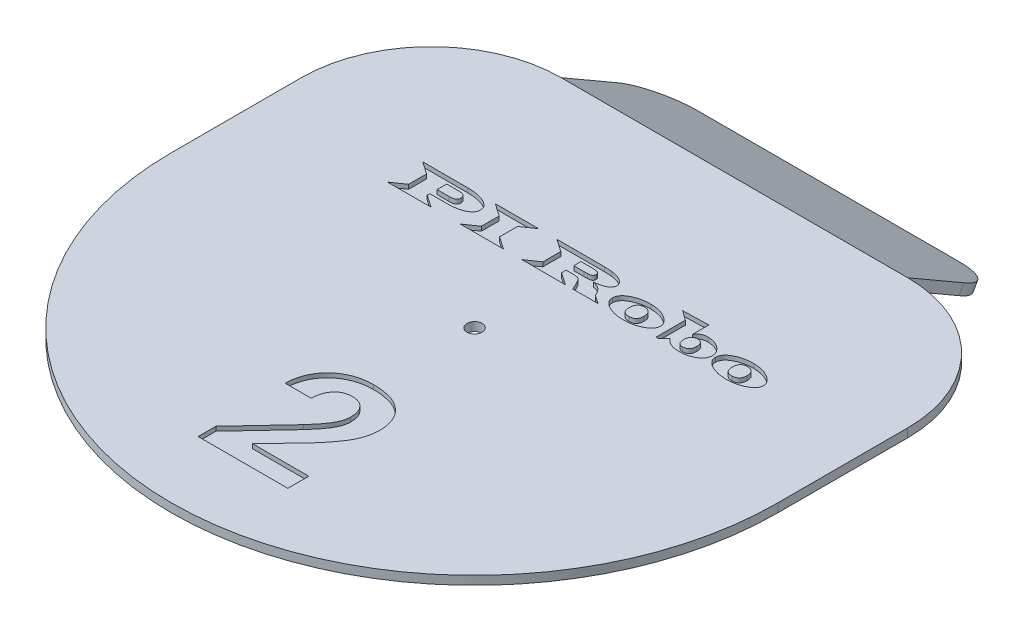
from build123d import *

# Parameters (mm, degrees)
BOSS_EXTRUDE1_DEPTH      = 2
CUT_EXTRUDE1_DEPTH       = 1
BOSS_EXTRUDE2_DEPTH      = 40
BOSS_EXTRUDE2_DEPTH_BACK = 40
FILLET1_R                = 10
SKETCH4_R                = 1.75
CUT_EXTRUDE2_DEPTH       = 10


with BuildPart() as part:
    # Sketch1 → Boss-Extrude1 (new body)
    with BuildSketch(Plane(origin=(0, 0, 0), x_dir=(1, 0, 0), z_dir=(0, 1, 0))):
        with BuildLine():
            Line((-70, 0), (-70, 30))
            ThreePointArc((-70, 30), (-61.213203436, 51.213203436), (-40, 60))
            Line((-40, 60), (40, 60))
            ThreePointArc((40, 60), (61.213203436, 51.213203436), (70, 30))
            Line((70, 30), (70, 0))
            ThreePointArc((70, 0), (0, -70), (-70, 0))
        make_face()
    extrude(amount=BOSS_EXTRUDE1_DEPTH)

    # Sketch2 → Cut-Extrude1 (cut)
    # profile 1 of 7: a face of its own
    with BuildSketch(Plane(origin=(0, 2, 0), x_dir=(1, 0, 0), z_dir=(0, 1, 0))):
        with BuildLine():
            Line((-39.182018294, 27.198253148), (-28.749726627, 27.198253148))
            add(Edge.make_bspline(
                [(-28.749726627, 27.198253148), (-28.540759959, 27.195390427), (-28.132309332, 27.189794894), (-27.533116335, 27.151819106), (-26.962310882, 27.086381694), (-26.418698697, 26.9942655), (-25.902645117, 26.877909568), (-25.415507649, 26.730919863), (-24.955205113, 26.561764658), (-24.593581705, 26.396517149), (-24.323397808, 26.250872451), (-24.132927126, 26.142968589), (-23.958369255, 26.027009202), (-23.793700105, 25.911944442), (-23.644545426, 25.789479814), (-23.50752858, 25.665135999), (-23.382824062, 25.537540619), (-23.271658186, 25.406045898), (-23.174286655, 25.269770395), (-23.088370956, 25.131127703), (-23.017400865, 24.987768113), (-22.957456562, 24.84191949), (-22.912798301, 24.691668437), (-22.879155703, 24.538606742), (-22.860046235, 24.38160638), (-22.857109273, 24.275847963), (-22.855629405, 24.222558703)],
                knots=[0, 0, 0, 0, 2.087090705, 4.079471203, 5.9937321, 7.822924926, 9.584003369, 11.273661289, 12.90132283, 14.478954604, 15.23919433, 15.966877183, 16.664247486, 17.331455289, 17.97238357, 18.590194536, 19.178789967, 19.753078417, 20.308078398, 20.850320854, 21.380223841, 21.90400754, 22.423307255, 22.943667391, 23.467738033, 24, 24, 24, 24], degree=3))
            add(Edge.make_bspline(
                [(-22.855629405, 24.222558703), (-22.860060003, 24.125569376), (-22.868814673, 23.933922676), (-22.935883952, 23.654189534), (-23.051721293, 23.392873945), (-23.208556639, 23.145487379), (-23.412378472, 22.91612731), (-23.661210728, 22.703416772), (-23.952635638, 22.505069889), (-24.288639882, 22.327061184), (-24.660432778, 22.164524204), (-25.066899353, 22.024072491), (-25.505283383, 21.907231711), (-25.975425694, 21.81037712), (-26.477808559, 21.73404163), (-27.013306908, 21.681871749), (-27.580879169, 21.647759699), (-27.970160464, 21.644413979), (-28.169865516, 21.642697592)],
                knots=[0, 0, 0, 0, 0.717437142, 1.41762465, 2.113884282, 2.824422768, 3.577074642, 4.375669699, 5.241708804, 6.180718279, 7.185744861, 8.242284492, 9.360224043, 10.541265472, 11.793337527, 13.119189121, 14.522116283, 16, 16, 16, 16], degree=3))
            Line((-28.169865516, 21.642697592), (-31.966740516, 21.642697592))
            Line((-31.966740516, 21.642697592), (-31.966740516, 21.042003148))
            Line((-31.966740516, 21.042003148), (-29.091740516, 19.087142037))
            Line((-29.091740516, 19.087142037), (-39.182018294, 19.087142037))
            Line((-39.182018294, 19.087142037), (-36.300073849, 21.07672537))
            Line((-36.300073849, 21.07672537), (-36.300073849, 25.226030925))
            Line((-36.300073849, 25.226030925), (-39.182018294, 27.198253148))
        make_face()
        with BuildLine():
            Line((-31.966740516, 23.309364259), (-29.197643294, 23.309364259))
            add(Edge.make_bspline(
                [(-29.197643294, 23.309364259), (-29.120089552, 23.310039255), (-28.970693699, 23.311339536), (-28.756291194, 23.320918206), (-28.561113752, 23.340260469), (-28.38594886, 23.365451864), (-28.229903407, 23.39847942), (-28.093156413, 23.437439826), (-27.97470326, 23.483565943), (-27.87537007, 23.540579242), (-27.789456128, 23.605437038), (-27.717687893, 23.683631865), (-27.656066808, 23.772670736), (-27.608204225, 23.87461018), (-27.569558544, 23.986920209), (-27.542484035, 24.110996586), (-27.524467019, 24.246916219), (-27.523038382, 24.341708201), (-27.522296071, 24.390961481)],
                knots=[0, 0, 0, 0, 1.607399621, 3.09641847, 4.446230494, 5.670930036, 6.762466651, 7.749348201, 8.615756757, 9.38935836, 10.116269223, 10.837617419, 11.579513673, 12.351998698, 13.163713441, 14.036656029, 14.979859599, 16, 16, 16, 16], degree=3))
            add(Edge.make_bspline(
                [(-27.522296071, 24.390961481), (-27.523639294, 24.437335118), (-27.526237082, 24.527021593), (-27.545951454, 24.656724995), (-27.576396819, 24.777798849), (-27.622333946, 24.889423949), (-27.679598175, 24.993357887), (-27.751691137, 25.087370188), (-27.835754701, 25.172873248), (-27.93174998, 25.250480778), (-28.043215945, 25.315811124), (-28.165403053, 25.374862169), (-28.301139771, 25.423456098), (-28.449232142, 25.463217042), (-28.610052989, 25.493614204), (-28.78327577, 25.516863908), (-28.969494751, 25.527828539), (-29.0980967, 25.530304829), (-29.164657183, 25.531586481)],
                knots=[0, 0, 0, 0, 0.979172184, 1.893716055, 2.765426739, 3.609882898, 4.436272778, 5.265100258, 6.10360728, 6.964623838, 7.864009384, 8.826325232, 9.82790424, 10.904344143, 12.06230992, 13.282913021, 14.593717879, 16, 16, 16, 16], degree=3))
            Line((-29.164657183, 25.531586481), (-31.966740516, 25.531586481))
            Line((-31.966740516, 25.531586481), (-31.966740516, 23.309364259))
        make_face(mode=Mode.SUBTRACT)
    # profile 2 of 7: a face of its own
    with BuildSketch(Plane(origin=(0, 2, 0), x_dir=(1, 0, 0), z_dir=(0, 1, 0))):
        Polygon((-22.404240516, 27.198253148), (-12.425073849, 27.198253148), (-15.300073849, 25.227767037), (-15.300073849, 21.069780925), (-12.425073849, 19.087142037), (-22.404240516, 19.087142037), (-19.522296071, 21.104503148), (-19.522296071, 25.191308703), align=None)
    # profile 3 of 7: a face of its own
    with BuildSketch(Plane(origin=(0, 2, 0), x_dir=(1, 0, 0), z_dir=(0, 1, 0))):
        with BuildLine():
            Line((-8.182018294, 27.198253148), (1.387426151, 27.198253148))
            Line((1.387426151, 27.198253148), (2.80756504, 27.198253148))
            Line((2.80756504, 27.198253148), (4.689509484, 27.083669814))
            add(Edge.make_bspline(
                [(4.689509484, 27.083669814), (4.810639646, 27.066865105), (5.04858905, 27.033853753), (5.395111728, 26.96604553), (5.724308705, 26.884595434), (6.035718856, 26.789361412), (6.329625963, 26.67981732), (6.606751409, 26.557746928), (6.863964998, 26.416914297), (7.104590193, 26.268580529), (7.320344193, 26.107299043), (7.511331198, 25.942165696), (7.670181748, 25.767836181), (7.805069797, 25.591607758), (7.90599309, 25.405243222), (7.980222888, 25.214839998), (8.025687829, 25.018093334), (8.030731786, 24.884828392), (8.033259484, 24.818044814)],
                knots=[0, 0, 0, 0, 1.344608738, 2.641363973, 3.880775494, 5.07247627, 6.220276055, 7.328437483, 8.399088701, 9.44265371, 10.43415842, 11.358504192, 12.214255043, 13.023748544, 13.792702854, 14.536082863, 15.266381527, 16, 16, 16, 16], degree=3))
            add(Edge.make_bspline(
                [(8.033259484, 24.818044814), (8.030613519, 24.752431957), (8.025434082, 24.623995789), (7.983672001, 24.436073568), (7.916255955, 24.258566088), (7.819814572, 24.090726935), (7.698250111, 23.932587561), (7.54770011, 23.785627793), (7.371636635, 23.648600443), (7.168021572, 23.521979386), (6.939070961, 23.403725427), (6.681180206, 23.299431776), (6.399218208, 23.199333289), (6.088001419, 23.114811052), (5.752200005, 23.033501891), (5.387831996, 22.967769569), (4.997793655, 22.907764913), (4.727840386, 22.87833833), (4.58881504, 22.863183703)],
                knots=[0, 0, 0, 0, 0.729034694, 1.427074301, 2.12984443, 2.83308586, 3.571939266, 4.341004906, 5.166209091, 6.048251972, 7.003835598, 8.028075508, 9.139355141, 10.329214249, 11.612323367, 12.980565391, 14.444997747, 16, 16, 16, 16], degree=3))
            add(Edge.make_bspline(
                [(4.58881504, 22.863183703), (4.67645449, 22.848814621), (4.84820599, 22.820654797), (5.096783198, 22.757880939), (5.333582892, 22.688307299), (5.556642997, 22.603247738), (5.765057873, 22.503112033), (5.962891339, 22.394324108), (6.146759384, 22.270864057), (6.319180477, 22.133802766), (6.482650613, 21.979789521), (6.642120379, 21.808550349), (6.796249065, 21.615757686), (6.949806926, 21.405668918), (7.098299037, 21.174366609), (7.244004989, 20.924011481), (7.386680298, 20.65476938), (7.475563229, 20.466564196), (7.521106706, 20.370128148)],
                knots=[0, 0, 0, 0, 1.051953778, 2.061567464, 3.035690898, 3.975611771, 4.886669183, 5.773901752, 6.648830882, 7.507784047, 8.381126039, 9.307946329, 10.278296702, 11.304336587, 12.390493941, 13.533755484, 14.736300084, 16, 16, 16, 16], degree=3))
            Line((7.521106706, 20.370128148), (9.442981706, 19.087142037))
            Line((9.442981706, 19.087142037), (3.576662262, 19.087142037))
            add(Edge.make_bspline(
                [(3.576662262, 19.087142037), (3.516208289, 19.228478863), (3.399209783, 19.50201254), (3.224630698, 19.896200522), (3.054143034, 20.25955204), (2.890058057, 20.592843467), (2.7300627, 20.895514862), (2.576384541, 21.16816438), (2.427379528, 21.410188059), (2.326036568, 21.5585568), (2.278051151, 21.628808703)],
                knots=[0, 0, 0, 0, 1.29035272, 2.497260861, 3.618578266, 4.659170008, 5.615275662, 6.491943265, 7.285942206, 8, 8, 8, 8], degree=3))
            add(Edge.make_bspline(
                [(2.278051151, 21.628808703), (2.247605457, 21.666074404), (2.184391473, 21.743448677), (2.057128762, 21.836735117), (1.903256483, 21.914920314), (1.720843924, 21.978301712), (1.510682302, 22.027214836), (1.272774236, 22.063661889), (1.006400903, 22.08350847), (0.819171208, 22.085890168), (0.720759484, 22.087142037)],
                knots=[0, 0, 0, 0, 0.686392361, 1.42514724, 2.236342754, 3.150536929, 4.181016092, 5.320691751, 6.591701259, 8, 8, 8, 8], degree=3))
            Line((0.720759484, 22.087142037), (-0.966740516, 22.087142037))
            Line((-0.966740516, 22.087142037), (-0.966740516, 21.040267037))
            Line((-0.966740516, 21.040267037), (1.915203929, 19.087142037))
            Line((1.915203929, 19.087142037), (-8.182018294, 19.087142037))
            Line((-8.182018294, 19.087142037), (-5.300073849, 21.074989259))
            Line((-5.300073849, 21.074989259), (-5.300073849, 25.20172537))
            Line((-5.300073849, 25.20172537), (-8.182018294, 27.198253148))
        make_face()
        with BuildLine():
            Line((-0.966740516, 23.864919814), (1.380481706, 23.863183703))
            Line((1.380481706, 23.863183703), (2.179092817, 23.875336481))
            add(Edge.make_bspline(
                [(2.179092817, 23.875336481), (2.271873322, 23.877079382), (2.446182228, 23.880353812), (2.688991367, 23.919404192), (2.897564284, 23.976737321), (3.067910404, 24.064801422), (3.204769874, 24.175308224), (3.298633933, 24.31607493), (3.357084197, 24.480325053), (3.363319809, 24.598191708), (3.366592817, 24.660058703)],
                knots=[0, 0, 0, 0, 1.381391365, 2.595252319, 3.656883097, 4.590505361, 5.435358798, 6.248761601, 7.080792983, 8, 8, 8, 8], degree=3))
            add(Edge.make_bspline(
                [(3.366592817, 24.660058703), (3.366068257, 24.701253112), (3.365064348, 24.780091402), (3.344284504, 24.892824901), (3.315878735, 24.995925087), (3.274439993, 25.088961364), (3.218979385, 25.170402077), (3.152730169, 25.242407343), (3.073348449, 25.303603086), (2.980408655, 25.355287231), (2.867741646, 25.396859261), (2.733422325, 25.435295284), (2.571904355, 25.4622639), (2.386329595, 25.489637857), (2.174025173, 25.506396313), (1.936880827, 25.523853685), (1.673315305, 25.528579785), (1.489272886, 25.530551276), (1.392634484, 25.531586481)],
                knots=[0, 0, 0, 0, 0.806113006, 1.54274748, 2.239247148, 2.899225326, 3.528461942, 4.162587489, 4.809271197, 5.484667002, 6.23882332, 7.158143537, 8.219420418, 9.445052395, 10.834583391, 12.392003997, 14.105485854, 16, 16, 16, 16], degree=3))
            Line((1.392634484, 25.531586481), (-0.966740516, 25.531586481))
            Line((-0.966740516, 25.531586481), (-0.966740516, 23.864919814))
        make_face(mode=Mode.SUBTRACT)
    # profile 4 of 7: a face of its own
    with BuildSketch(Plane(origin=(0, 2, 0), x_dir=(1, 0, 0), z_dir=(0, 1, 0))):
        with BuildLine():
            add(Edge.make_bspline(
                [(15.614856706, 25.087142037), (15.793769589, 25.084153637), (16.147012444, 25.078253387), (16.668575836, 25.031063944), (17.173832419, 24.950012283), (17.66466613, 24.842286109), (18.139069404, 24.698373913), (18.59944618, 24.527349048), (19.042857226, 24.321364848), (19.397663775, 24.125202169), (19.668197063, 23.956614074), (19.858576045, 23.828004037), (20.035159336, 23.695687023), (20.200529784, 23.563519087), (20.349911546, 23.425955108), (20.490197739, 23.290868067), (20.612633965, 23.148073178), (20.726583736, 23.007536077), (20.824222944, 22.861699931), (20.909208156, 22.714238698), (20.982744627, 22.564997064), (21.042144529, 22.413457276), (21.087293466, 22.259375459), (21.120653108, 22.103364244), (21.139909658, 21.944683177), (21.142881328, 21.838348745), (21.144370595, 21.785058703)],
                knots=[0, 0, 0, 0, 1.837849433, 3.628621764, 5.374288145, 7.092166258, 8.786843572, 10.463108596, 12.133586095, 13.804729968, 14.624608915, 15.407866565, 16.164101214, 16.891120617, 17.581379905, 18.249813131, 18.890187209, 19.512279102, 20.107542945, 20.690840616, 21.259844263, 21.815172851, 22.360708781, 22.907571302, 23.452523806, 24, 24, 24, 24], degree=3))
            add(Edge.make_bspline(
                [(21.144370595, 21.785058703), (21.142867231, 21.734084775), (21.139867299, 21.632367348), (21.120884582, 21.481108264), (21.08690869, 21.332767348), (21.042606214, 21.186444722), (20.982139537, 21.043744338), (20.911723392, 20.902430449), (20.825148577, 20.76540908), (20.728550725, 20.629174113), (20.61606308, 20.497749608), (20.493203684, 20.366737635), (20.355503578, 20.240654429), (20.205374045, 20.116701402), (20.041950161, 19.995917548), (19.866670988, 19.875388287), (19.677295259, 19.759783216), (19.407048417, 19.608529495), (19.050957458, 19.43394488), (18.603183439, 19.249953123), (18.133399201, 19.099200051), (17.644691325, 18.970761108), (17.134438937, 18.875330629), (16.604967331, 18.803528854), (16.054196864, 18.761554013), (15.680321193, 18.756422741), (15.489856706, 18.753808703)],
                knots=[0, 0, 0, 0, 0.525963223, 1.049548814, 1.569581853, 2.094595316, 2.624609663, 3.166661502, 3.721710915, 4.295021523, 4.888256967, 5.504887899, 6.147118798, 6.81297789, 7.512746824, 8.243077163, 9.006998881, 9.80092105, 11.437772379, 13.095367525, 14.790917316, 16.524372204, 18.305450123, 20.142890536, 22.035062367, 24, 24, 24, 24], degree=3))
            add(Edge.make_bspline(
                [(15.489856706, 18.753808703), (15.302844342, 18.756224201), (14.934665028, 18.760979695), (14.392792135, 18.805999567), (13.870291891, 18.876051863), (13.367952377, 18.976453151), (12.886109815, 19.106826858), (12.42447096, 19.265244293), (11.982316562, 19.450520329), (11.631796861, 19.630044603), (11.366480107, 19.785729293), (11.180387478, 19.905416359), (11.007353128, 20.028432672), (10.845807909, 20.153523213), (10.699353715, 20.284232318), (10.562078752, 20.41538977), (10.441633959, 20.553418628), (10.330925601, 20.691847252), (10.235264987, 20.835126712), (10.152231473, 20.980952273), (10.079292646, 21.129206736), (10.023298251, 21.282123344), (9.976513221, 21.437731169), (9.946527888, 21.597245526), (9.926363296, 21.759663117), (9.923560455, 21.868909049), (9.922148373, 21.923947592)],
                knots=[0, 0, 0, 0, 1.921282108, 3.782511005, 5.583019273, 7.33580106, 9.042267682, 10.708389971, 12.347326821, 13.96427154, 14.750571526, 15.507660561, 16.236939724, 16.931627978, 17.605701104, 18.253287615, 18.880937619, 19.486451197, 20.073582837, 20.648881512, 21.210054547, 21.76892296, 22.320274907, 22.877717916, 23.434589742, 24, 24, 24, 24], degree=3))
            add(Edge.make_bspline(
                [(9.922148373, 21.923947592), (9.923597535, 21.978975667), (9.926458841, 22.087626141), (9.945874297, 22.24918101), (9.979190149, 22.406944536), (10.024482019, 22.56268214), (10.082921798, 22.715271479), (10.157630103, 22.863381088), (10.241433926, 23.00973635), (10.342397832, 23.150313297), (10.452942868, 23.289991181), (10.578579496, 23.42488254), (10.716648001, 23.557441123), (10.866832477, 23.687334271), (11.031725127, 23.812483753), (11.20849422, 23.936015502), (11.3995843, 24.05513842), (11.67182125, 24.21095495), (12.03109389, 24.390462124), (12.483622441, 24.575722001), (12.955660056, 24.734120687), (13.447898593, 24.864466079), (13.961179235, 24.965065702), (14.494695173, 25.03479231), (15.048101033, 25.080037723), (15.423793512, 25.084747049), (15.614856706, 25.087142037)],
                knots=[0, 0, 0, 0, 0.557156565, 1.100080723, 1.644804269, 2.188107741, 2.740902632, 3.296454622, 3.866285149, 4.446653232, 5.046970628, 5.668973566, 6.311316644, 6.98438203, 7.678195975, 8.406416597, 9.167286984, 9.957314225, 11.582023668, 13.229492501, 14.904583907, 16.620100403, 18.381779528, 20.196652527, 22.065759217, 24, 24, 24, 24], degree=3))
        make_face()
        with BuildLine():
            add(Edge.make_bspline(
                [(15.460342817, 23.753808703), (15.393716389, 23.752724139), (15.264105477, 23.750614294), (15.076579073, 23.72719872), (14.901267938, 23.691656451), (14.739599384, 23.63937161), (14.590066856, 23.573321859), (14.454243935, 23.491534374), (14.331559958, 23.394937575), (14.220996808, 23.284569665), (14.123072604, 23.158911749), (14.040206847, 23.016964346), (13.968963774, 22.861624272), (13.909479389, 22.692124611), (13.864694989, 22.507156371), (13.834559147, 22.307271434), (13.815059429, 22.093311556), (13.812404305, 21.945983093), (13.811037262, 21.870128148)],
                knots=[0, 0, 0, 0, 1.114286815, 2.167664299, 3.157145725, 4.103416758, 5.005031699, 5.886877054, 6.748934553, 7.611698813, 8.494978539, 9.406728952, 10.355622403, 11.350962156, 12.407850093, 13.535022166, 14.730857883, 16, 16, 16, 16], degree=3))
            add(Edge.make_bspline(
                [(13.811037262, 21.870128148), (13.812468457, 21.798328986), (13.815255304, 21.658520466), (13.833920725, 21.455909765), (13.86640928, 21.267008986), (13.914018465, 21.092478171), (13.971692454, 20.930583493), (14.045250901, 20.783169939), (14.132611656, 20.650737603), (14.231985991, 20.530995875), (14.346496341, 20.426324571), (14.472892206, 20.333872821), (14.613801664, 20.257017952), (14.767143132, 20.194848344), (14.933476598, 20.146034494), (15.113125664, 20.111888791), (15.3059061, 20.090849699), (15.43887499, 20.088400742), (15.507217817, 20.087142037)],
                knots=[0, 0, 0, 0, 1.220666772, 2.376902632, 3.455829822, 4.474958959, 5.449215644, 6.373240998, 7.268316841, 8.141327852, 9.011673513, 9.899255415, 10.797569994, 11.733048495, 12.707503886, 13.73984573, 14.838334792, 16, 16, 16, 16], degree=3))
            add(Edge.make_bspline(
                [(15.507217817, 20.087142037), (15.577872495, 20.088392032), (15.714877867, 20.090815878), (15.913453885, 20.111829646), (16.098719254, 20.146428241), (16.270615814, 20.194100127), (16.428645416, 20.257531418), (16.573342733, 20.332996583), (16.703254743, 20.424967049), (16.820392792, 20.529242638), (16.923668866, 20.64830019), (17.012170826, 20.781875735), (17.089679396, 20.927785646), (17.149117825, 21.089471011), (17.198966881, 21.263246153), (17.230021803, 21.452022179), (17.252014747, 21.653752201), (17.254302463, 21.793093782), (17.255481706, 21.864919814)],
                knots=[0, 0, 0, 0, 1.185313575, 2.298422863, 3.345893796, 4.344939956, 5.286204345, 6.198419916, 7.076667119, 7.950015545, 8.824227283, 9.712987041, 10.633793322, 11.589620999, 12.598014559, 13.662850415, 14.795275753, 16, 16, 16, 16], degree=3))
            add(Edge.make_bspline(
                [(17.255481706, 21.864919814), (17.254269325, 21.941365679), (17.251922382, 22.089350554), (17.230451254, 22.303971681), (17.197298642, 22.504185868), (17.145753699, 22.688973793), (17.08432752, 22.859956157), (17.007554865, 23.016494332), (16.915208917, 23.156937717), (16.81005856, 23.284215867), (16.68978285, 23.395690296), (16.554482804, 23.491513963), (16.406321446, 23.573877181), (16.243268274, 23.639239116), (16.067325896, 23.691898403), (15.876970047, 23.727083815), (15.673321237, 23.750673282), (15.532752974, 23.752742697), (15.460342817, 23.753808703)],
                knots=[0, 0, 0, 0, 1.227077254, 2.375391733, 3.459985042, 4.481108371, 5.451198118, 6.373708035, 7.273140296, 8.143993249, 9.018457355, 9.897696895, 10.800195628, 11.733683763, 12.712677056, 13.744105889, 14.837933656, 16, 16, 16, 16], degree=3))
        make_face(mode=Mode.SUBTRACT)
    # profile 5 of 7: a face of its own
    with BuildSketch(Plane(origin=(0, 2, 0), x_dir=(1, 0, 0), z_dir=(0, 1, 0))):
        with BuildLine():
            Line((26.477703929, 27.594086481), (26.477703929, 23.859711481))
            add(Edge.make_bspline(
                [(26.477703929, 23.859711481), (26.539368291, 23.957632587), (26.659682943, 24.148688543), (26.881000339, 24.399828747), (27.126381252, 24.614160829), (27.40132679, 24.786946349), (27.700329312, 24.924242809), (28.026850413, 25.018520444), (28.378366297, 25.077119972), (28.621559561, 25.083735249), (28.746801151, 25.087142037)],
                knots=[0, 0, 0, 0, 1.022279641, 1.99459159, 2.949099627, 3.894947189, 4.857112196, 5.850053645, 6.892803625, 8, 8, 8, 8], degree=3))
            add(Edge.make_bspline(
                [(28.746801151, 25.087142037), (28.891011843, 25.084070687), (29.174942826, 25.078023622), (29.593023976, 25.032313796), (29.995193639, 24.955765351), (30.382304175, 24.850200075), (30.753674445, 24.712739629), (31.109025931, 24.542882124), (31.450049396, 24.345403019), (31.770348393, 24.118817431), (32.064638525, 23.874276528), (32.323476714, 23.615023356), (32.542675718, 23.345007022), (32.721208857, 23.063438457), (32.862126382, 22.771966422), (32.961399811, 22.469050409), (33.02293828, 22.155614063), (33.029799628, 21.942745546), (33.033259484, 21.835405925)],
                knots=[0, 0, 0, 0, 1.165419286, 2.294549992, 3.394442227, 4.47129857, 5.53388993, 6.590441884, 7.650992988, 8.715096554, 9.757735274, 10.740033284, 11.671400499, 12.562861118, 13.428978512, 14.280948806, 15.133163014, 16, 16, 16, 16], degree=3))
            add(Edge.make_bspline(
                [(33.033259484, 21.835405925), (33.029524581, 21.733770367), (33.022126843, 21.532460441), (32.954569436, 21.237772757), (32.847968302, 20.954568823), (32.696537165, 20.68397598), (32.502782959, 20.425484099), (32.268280079, 20.177724818), (31.989816931, 19.943122135), (31.672376858, 19.724520391), (31.326152786, 19.521855565), (30.954818195, 19.347272817), (30.565196121, 19.197077583), (30.155592794, 19.076325642), (29.727674867, 18.980373), (29.279796395, 18.913275597), (28.812360006, 18.873009524), (28.493988536, 18.867649296), (28.331870595, 18.864919814)],
                knots=[0, 0, 0, 0, 0.796237427, 1.577110405, 2.358629598, 3.163259, 4.000308037, 4.886570474, 5.833375326, 6.850819788, 7.906529186, 8.976584172, 10.065743852, 11.178790693, 12.323019612, 13.502967579, 14.72848608, 16, 16, 16, 16], degree=3))
            add(Edge.make_bspline(
                [(28.331870595, 18.864919814), (28.228820001, 18.86552244), (28.026580835, 18.866705108), (27.729029558, 18.887764057), (27.442494979, 18.915150502), (27.167138569, 18.960322924), (26.902457711, 19.012387484), (26.648808073, 19.079392795), (26.406245404, 19.156754678), (26.17471802, 19.246921367), (25.954841187, 19.35048571), (25.745034466, 19.463551686), (25.54763092, 19.592182377), (25.360585981, 19.730300322), (25.183507874, 19.88039824), (25.019601656, 20.043675689), (24.864616926, 20.217902014), (24.772457975, 20.343319067), (24.725967817, 20.406586481)],
                knots=[0, 0, 0, 0, 1.211015256, 2.376645362, 3.504997887, 4.593162494, 5.655092037, 6.674762434, 7.675098661, 8.646521921, 9.592948578, 10.530533145, 11.445664068, 12.359934977, 13.262310394, 14.171429582, 15.077566246, 16, 16, 16, 16], degree=3))
            Line((24.725967817, 20.406586481), (23.304092817, 19.087142037))
            Line((23.304092817, 19.087142037), (22.811037262, 19.087142037))
            Line((22.811037262, 19.087142037), (22.811037262, 25.851030925))
            Line((22.811037262, 25.851030925), (20.585342817, 27.45172537))
            Line((20.585342817, 27.45172537), (26.477703929, 27.594086481))
        make_face()
        with BuildLine():
            add(Edge.make_bspline(
                [(27.965551151, 23.531586481), (27.915688711, 23.530446919), (27.817169124, 23.528195341), (27.672381036, 23.504392201), (27.532792562, 23.468025228), (27.397905473, 23.417724139), (27.269208441, 23.350899722), (27.145399312, 23.270620194), (27.026539517, 23.176163691), (26.914485792, 23.067755388), (26.812892133, 22.94626), (26.721470244, 22.816556323), (26.646990688, 22.67536831), (26.583579516, 22.526584765), (26.537823941, 22.367076858), (26.502447647, 22.199535788), (26.481547889, 22.022275083), (26.479002926, 21.900853837), (26.477703929, 21.838878148)],
                knots=[0, 0, 0, 0, 0.950082381, 1.877199043, 2.789952221, 3.697956497, 4.615964793, 5.549560977, 6.507811868, 7.506756779, 8.517036136, 9.524176473, 10.52646835, 11.555321562, 12.6028262, 13.684984479, 14.818372503, 16, 16, 16, 16], degree=3))
            add(Edge.make_bspline(
                [(26.477703929, 21.838878148), (26.478679159, 21.772877035), (26.48057265, 21.644730273), (26.495872945, 21.458447874), (26.523283141, 21.284897687), (26.562267951, 21.124539655), (26.607400474, 20.9750897), (26.66905829, 20.840427658), (26.73863514, 20.717317408), (26.818301681, 20.606558135), (26.911629541, 20.510715883), (27.014722922, 20.42678006), (27.128034477, 20.354892835), (27.253211203, 20.297511743), (27.388227772, 20.252465557), (27.534445661, 20.221607076), (27.690730599, 20.202321746), (27.798825745, 20.199635305), (27.85444004, 20.198253148)],
                knots=[0, 0, 0, 0, 1.292162163, 2.508842517, 3.656337638, 4.728164974, 5.738707595, 6.707410992, 7.620931959, 8.50480957, 9.370265691, 10.232079648, 11.102859884, 11.989999715, 12.921611963, 13.883932619, 14.911296198, 16, 16, 16, 16], degree=3))
            add(Edge.make_bspline(
                [(27.85444004, 20.198253148), (27.9152742, 20.199472428), (28.033844229, 20.201848889), (28.205633749, 20.223527833), (28.366343109, 20.255529457), (28.514971944, 20.302361443), (28.651684089, 20.363827207), (28.777345983, 20.437754511), (28.889656297, 20.528180024), (28.990648752, 20.630613502), (29.079759579, 20.746956304), (29.158906922, 20.875398233), (29.22159792, 21.019359389), (29.277278311, 21.174780179), (29.315135645, 21.345321074), (29.344639868, 21.528473663), (29.364800679, 21.725010571), (29.365982834, 21.860816904), (29.366592817, 21.930892037)],
                knots=[0, 0, 0, 0, 1.107758089, 2.159097921, 3.149469302, 4.089698034, 4.990998729, 5.87511836, 6.737860228, 7.610083061, 8.48941273, 9.402474813, 10.350883438, 11.344448038, 12.405678595, 13.527048282, 14.723973959, 16, 16, 16, 16], degree=3))
            add(Edge.make_bspline(
                [(29.366592817, 21.930892037), (29.365898879, 21.995762186), (29.364557831, 22.121125025), (29.345639302, 22.302416441), (29.321114077, 22.471608069), (29.283196117, 22.628736874), (29.23195664, 22.772705852), (29.174348916, 22.90607446), (29.101671502, 23.025671983), (29.018778581, 23.132598462), (28.926267105, 23.228719917), (28.820015839, 23.307943852), (28.705492568, 23.379204934), (28.577097001, 23.43322929), (28.439981181, 23.479463189), (28.291373981, 23.510239499), (28.132029628, 23.527018763), (28.022304196, 23.530029331), (27.965551151, 23.531586481)],
                knots=[0, 0, 0, 0, 1.276677762, 2.467204882, 3.585640142, 4.641368977, 5.64320646, 6.59192373, 7.496718486, 8.390177138, 9.252351838, 10.11384858, 10.993245366, 11.901477695, 12.849167955, 13.839206816, 14.882377683, 16, 16, 16, 16], degree=3))
        make_face(mode=Mode.SUBTRACT)
    # profile 6 of 7: a face of its own
    with BuildSketch(Plane(origin=(0, 2, 0), x_dir=(1, 0, 0), z_dir=(0, 1, 0))):
        with BuildLine():
            add(Edge.make_bspline(
                [(39.392634484, 25.087142037), (39.571547367, 25.084153637), (39.924790222, 25.078253387), (40.446353614, 25.031063944), (40.951610196, 24.950012283), (41.442443907, 24.842286109), (41.916847182, 24.698373913), (42.377223958, 24.527349048), (42.820635004, 24.321364848), (43.175441552, 24.125202169), (43.445974841, 23.956614074), (43.636353823, 23.828004037), (43.812937114, 23.695687023), (43.978307562, 23.563519087), (44.127689324, 23.425955108), (44.267975517, 23.290868067), (44.390411743, 23.148073178), (44.504361514, 23.007536077), (44.602000721, 22.861699931), (44.686985934, 22.714238698), (44.760522405, 22.564997064), (44.819922307, 22.413457276), (44.865071244, 22.259375459), (44.898430886, 22.103364244), (44.917687435, 21.944683177), (44.920659105, 21.838348745), (44.922148373, 21.785058703)],
                knots=[0, 0, 0, 0, 1.837849433, 3.628621764, 5.374288145, 7.092166258, 8.786843572, 10.463108596, 12.133586095, 13.804729968, 14.624608915, 15.407866565, 16.164101214, 16.891120617, 17.581379905, 18.249813131, 18.890187209, 19.512279102, 20.107542945, 20.690840616, 21.259844263, 21.815172851, 22.360708781, 22.907571302, 23.452523806, 24, 24, 24, 24], degree=3))
            add(Edge.make_bspline(
                [(44.922148373, 21.785058703), (44.920645009, 21.734084775), (44.917645077, 21.632367348), (44.89866236, 21.481108264), (44.864686468, 21.332767348), (44.820383992, 21.186444722), (44.759917315, 21.043744338), (44.68950117, 20.902430449), (44.602926354, 20.76540908), (44.506328503, 20.629174113), (44.393840857, 20.497749608), (44.270981462, 20.366737635), (44.133281356, 20.240654429), (43.983151823, 20.116701402), (43.819727939, 19.995917548), (43.644448765, 19.875388287), (43.455073036, 19.759783216), (43.184826195, 19.608529495), (42.828735236, 19.43394488), (42.380961217, 19.249953123), (41.911176979, 19.099200051), (41.422469103, 18.970761108), (40.912216715, 18.875330629), (40.382745109, 18.803528854), (39.831974642, 18.761554013), (39.458098971, 18.756422741), (39.267634484, 18.753808703)],
                knots=[0, 0, 0, 0, 0.525963223, 1.049548814, 1.569581853, 2.094595316, 2.624609663, 3.166661502, 3.721710915, 4.295021523, 4.888256967, 5.504887899, 6.147118798, 6.81297789, 7.512746824, 8.243077163, 9.006998881, 9.80092105, 11.437772379, 13.095367525, 14.790917316, 16.524372204, 18.305450123, 20.142890536, 22.035062367, 24, 24, 24, 24], degree=3))
            add(Edge.make_bspline(
                [(39.267634484, 18.753808703), (39.08062212, 18.756224201), (38.712442806, 18.760979695), (38.170569913, 18.805999567), (37.648069669, 18.876051863), (37.145730155, 18.976453151), (36.663887592, 19.106826858), (36.202248738, 19.265244293), (35.760094339, 19.450520329), (35.409574638, 19.630044603), (35.144257884, 19.785729293), (34.958165256, 19.905416359), (34.785130906, 20.028432672), (34.623585686, 20.153523213), (34.477131492, 20.284232318), (34.339856529, 20.41538977), (34.219411737, 20.553418628), (34.108703378, 20.691847252), (34.013042765, 20.835126712), (33.930009251, 20.980952273), (33.857070424, 21.129206736), (33.801076029, 21.282123344), (33.754290999, 21.437731169), (33.724305666, 21.597245526), (33.704141074, 21.759663117), (33.701338233, 21.868909049), (33.699926151, 21.923947592)],
                knots=[0, 0, 0, 0, 1.921282108, 3.782511005, 5.583019273, 7.33580106, 9.042267682, 10.708389971, 12.347326821, 13.96427154, 14.750571526, 15.507660561, 16.236939724, 16.931627978, 17.605701104, 18.253287615, 18.880937619, 19.486451197, 20.073582837, 20.648881512, 21.210054547, 21.76892296, 22.320274907, 22.877717916, 23.434589742, 24, 24, 24, 24], degree=3))
            add(Edge.make_bspline(
                [(33.699926151, 21.923947592), (33.701375313, 21.978975667), (33.704236619, 22.087626141), (33.723652075, 22.24918101), (33.756967927, 22.406944536), (33.802259796, 22.56268214), (33.860699575, 22.715271479), (33.935407881, 22.863381088), (34.019211704, 23.00973635), (34.12017561, 23.150313297), (34.230720646, 23.289991181), (34.356357274, 23.42488254), (34.494425779, 23.557441123), (34.644610255, 23.687334271), (34.809502904, 23.812483753), (34.986271998, 23.936015502), (35.177362078, 24.05513842), (35.449599028, 24.21095495), (35.808871668, 24.390462124), (36.261400219, 24.575722001), (36.733437834, 24.734120687), (37.22567637, 24.864466079), (37.738957013, 24.965065702), (38.27247295, 25.03479231), (38.82587881, 25.080037723), (39.20157129, 25.084747049), (39.392634484, 25.087142037)],
                knots=[0, 0, 0, 0, 0.557156565, 1.100080723, 1.644804269, 2.188107741, 2.740902632, 3.296454622, 3.866285149, 4.446653232, 5.046970628, 5.668973566, 6.311316644, 6.98438203, 7.678195975, 8.406416597, 9.167286984, 9.957314225, 11.582023668, 13.229492501, 14.904583907, 16.620100403, 18.381779528, 20.196652527, 22.065759217, 24, 24, 24, 24], degree=3))
        make_face()
        with BuildLine():
            add(Edge.make_bspline(
                [(39.238120595, 23.753808703), (39.171494167, 23.752724139), (39.041883255, 23.750614294), (38.854356851, 23.72719872), (38.679045715, 23.691656451), (38.517377162, 23.63937161), (38.367844634, 23.573321859), (38.232021713, 23.491534374), (38.109337736, 23.394937575), (37.998774586, 23.284569665), (37.900850381, 23.158911749), (37.817984625, 23.016964346), (37.746741552, 22.861624272), (37.687257167, 22.692124611), (37.642472766, 22.507156371), (37.612336925, 22.307271434), (37.592837207, 22.093311556), (37.590182082, 21.945983093), (37.58881504, 21.870128148)],
                knots=[0, 0, 0, 0, 1.114286815, 2.167664299, 3.157145725, 4.103416758, 5.005031699, 5.886877054, 6.748934553, 7.611698813, 8.494978539, 9.406728952, 10.355622403, 11.350962156, 12.407850093, 13.535022166, 14.730857883, 16, 16, 16, 16], degree=3))
            add(Edge.make_bspline(
                [(37.58881504, 21.870128148), (37.590246235, 21.798328986), (37.593033081, 21.658520466), (37.611698503, 21.455909765), (37.644187058, 21.267008986), (37.691796243, 21.092478171), (37.749470232, 20.930583493), (37.823028679, 20.783169939), (37.910389434, 20.650737603), (38.009763769, 20.530995875), (38.124274119, 20.426324571), (38.250669984, 20.333872821), (38.391579442, 20.257017952), (38.54492091, 20.194848344), (38.711254375, 20.146034494), (38.890903442, 20.111888791), (39.083683878, 20.090849699), (39.216652768, 20.088400742), (39.284995595, 20.087142037)],
                knots=[0, 0, 0, 0, 1.220666772, 2.376902632, 3.455829822, 4.474958959, 5.449215644, 6.373240998, 7.268316841, 8.141327852, 9.011673513, 9.899255415, 10.797569994, 11.733048495, 12.707503886, 13.73984573, 14.838334792, 16, 16, 16, 16], degree=3))
            add(Edge.make_bspline(
                [(39.284995595, 20.087142037), (39.355650273, 20.088392032), (39.492655644, 20.090815878), (39.691231663, 20.111829646), (39.876497031, 20.146428241), (40.048393592, 20.194100127), (40.206423194, 20.257531418), (40.351120511, 20.332996583), (40.481032521, 20.424967049), (40.59817057, 20.529242638), (40.701446644, 20.64830019), (40.789948604, 20.781875735), (40.867457174, 20.927785646), (40.926895602, 21.089471011), (40.976744659, 21.263246153), (41.00779958, 21.452022179), (41.029792524, 21.653752201), (41.032080241, 21.793093782), (41.033259484, 21.864919814)],
                knots=[0, 0, 0, 0, 1.185313575, 2.298422863, 3.345893796, 4.344939956, 5.286204345, 6.198419916, 7.076667119, 7.950015545, 8.824227283, 9.712987041, 10.633793322, 11.589620999, 12.598014559, 13.662850415, 14.795275753, 16, 16, 16, 16], degree=3))
            add(Edge.make_bspline(
                [(41.033259484, 21.864919814), (41.032047103, 21.941365679), (41.02970016, 22.089350554), (41.008229032, 22.303971681), (40.97507642, 22.504185868), (40.923531476, 22.688973793), (40.862105298, 22.859956157), (40.785332643, 23.016494332), (40.692986695, 23.156937717), (40.587836338, 23.284215867), (40.467560628, 23.395690296), (40.332260582, 23.491513963), (40.184099223, 23.573877181), (40.021046052, 23.639239116), (39.845103673, 23.691898403), (39.654747825, 23.727083815), (39.451099015, 23.750673282), (39.310530752, 23.752742697), (39.238120595, 23.753808703)],
                knots=[0, 0, 0, 0, 1.227077254, 2.375391733, 3.459985042, 4.481108371, 5.451198118, 6.373708035, 7.273140296, 8.143993249, 9.018457355, 9.897696895, 10.800195628, 11.733683763, 12.712677056, 13.744105889, 14.837933656, 16, 16, 16, 16], degree=3))
        make_face(mode=Mode.SUBTRACT)
    # profile 7 of 7: a face of its own
    with BuildSketch(Plane(origin=(0, 2, 0), x_dir=(1, 0, 0), z_dir=(0, 1, 0))):
        with BuildLine():
            Line((10.535667772, -53.644520231), (-10.167754281, -53.644520231))
            Line((-10.167754281, -53.644520231), (-10.167754281, -49.526649509))
            Line((-10.167754281, -49.526649509), (-0.397792304, -39.123607684))
            add(Edge.make_bspline(
                [(-0.397792304, -39.123607684), (-0.083155085, -38.770553408), (0.516565854, -38.097606823), (1.326326874, -37.101171932), (2.010338776, -36.177245946), (2.569361027, -35.316621912), (2.999476138, -34.496482924), (3.31783148, -33.706848891), (3.501135984, -32.928522523), (3.529473639, -32.415327312), (3.543272335, -32.165432779)],
                knots=[0, 0, 0, 0, 1.390040402, 2.649515965, 3.772885056, 4.768162403, 5.663040596, 6.491213625, 7.265313745, 8, 8, 8, 8], degree=3))
            add(Edge.make_bspline(
                [(3.543272335, -32.165432779), (3.53315941, -31.846781909), (3.513870559, -31.239004334), (3.316292137, -30.381714492), (2.997986476, -29.628759049), (2.616496447, -29.094416502), (2.261825663, -28.726311699), (1.961243097, -28.493766867), (1.639754188, -28.28788023), (1.28395474, -28.132294788), (0.90606532, -28.005580127), (0.501098459, -27.914461463), (0.069715909, -27.855797722), (-0.228392738, -27.850598378), (-0.380682037, -27.847942285)],
                knots=[0, 0, 0, 0, 1.730959706, 3.301539679, 4.756029247, 6.150710988, 6.845516205, 7.530397339, 8.213401654, 8.917003676, 9.636540599, 10.37919517, 11.172009146, 12, 12, 12, 12], degree=3))
            add(Edge.make_bspline(
                [(-0.380682037, -27.847942285), (-0.544318372, -27.852875431), (-0.865207644, -27.862549283), (-1.334960358, -27.922122706), (-1.777041423, -28.040109471), (-2.194054421, -28.193147707), (-2.588187108, -28.38624842), (-2.946655111, -28.635176996), (-3.281718841, -28.923391204), (-3.587393688, -29.252657136), (-3.861294054, -29.618722889), (-4.099069708, -30.01342945), (-4.310101295, -30.42998323), (-4.464310779, -30.881235691), (-4.60008865, -31.353916556), (-4.68707742, -31.858771656), (-4.747544316, -32.388287937), (-4.752621436, -32.750800142), (-4.755206752, -32.935394756)],
                knots=[0, 0, 0, 0, 1.039190551, 2.037842629, 2.998116323, 3.937606229, 4.855286517, 5.77597846, 6.70030296, 7.656852145, 8.622497089, 9.597526558, 10.579999108, 11.580327573, 12.61993865, 13.699562519, 14.828595665, 16, 16, 16, 16], degree=3))
            Line((-4.755206752, -32.935394756), (-10.772317018, -32.935394756))
            add(Edge.make_bspline(
                [(-10.772317018, -32.935394756), (-10.766998903, -32.707162683), (-10.75647961, -32.255716999), (-10.700969068, -31.586546864), (-10.598197914, -30.932641541), (-10.447398665, -30.295854867), (-10.266524944, -29.671937906), (-10.04322203, -29.063288566), (-9.774192074, -28.471691353), (-9.467751776, -27.894913782), (-9.118629199, -27.34514856), (-8.743119341, -26.815155645), (-8.326134663, -26.322307925), (-7.878894206, -25.854800873), (-7.394578415, -25.424421326), (-6.877608596, -25.020494042), (-6.324121856, -24.653279932), (-5.741746425, -24.308404634), (-5.130576535, -24.001855446), (-4.49345584, -23.74214377), (-3.842944558, -23.509016617), (-3.166963285, -23.328781571), (-2.471748997, -23.186759274), (-1.757879431, -23.082408643), (-1.024138343, -23.027254534), (-0.529052177, -23.016761062), (-0.27802044, -23.011440384)],
                knots=[0, 0, 0, 0, 1.016324702, 2.010302033, 2.987229245, 3.960482403, 4.922070545, 5.878128836, 6.844177402, 7.813631729, 8.783566341, 9.741982455, 10.703309766, 11.655161951, 12.620320081, 13.585441093, 14.573816064, 15.575512538, 16.597601873, 17.614666552, 18.63731655, 19.672224299, 20.726373278, 21.795371107, 22.882150506, 24, 24, 24, 24], degree=3))
            add(Edge.make_bspline(
                [(-0.27802044, -23.011440384), (0.100620798, -23.016949027), (0.838632219, -23.027685951), (1.910968883, -23.141513217), (2.920994664, -23.307296654), (3.865001631, -23.55116132), (4.742435769, -23.872810049), (5.556280314, -24.259040881), (6.302766219, -24.719397676), (6.985703991, -25.242760499), (7.588431207, -25.838022521), (8.121693102, -26.486802411), (8.56462985, -27.19824557), (8.936714966, -27.962819286), (9.211080099, -28.790968979), (9.418504669, -29.670196652), (9.538799014, -30.608880532), (9.553050624, -31.252541596), (9.560382601, -31.58368373)],
                knots=[0, 0, 0, 0, 1.226314176, 2.390214741, 3.489937642, 4.540214396, 5.543772969, 6.513550469, 7.453770114, 8.380270605, 9.294963598, 10.192510269, 11.094841977, 12.003980671, 12.940905793, 13.915055199, 14.927365491, 16, 16, 16, 16], degree=3))
            add(Edge.make_bspline(
                [(9.560382601, -31.58368373), (9.545391969, -31.961096709), (9.51509572, -32.723852897), (9.287030821, -33.869371226), (8.918026222, -35.021956908), (8.490866269, -35.981268694), (8.068454141, -36.759583731), (7.702481525, -37.379950667), (7.280583062, -38.019008576), (6.810218012, -38.68578958), (6.283795204, -39.373689707), (5.71047264, -40.08949951), (5.085490188, -40.829946464), (4.64346544, -41.322497148), (4.415895909, -41.576079167)],
                knots=[0, 0, 0, 0, 1.180878801, 2.386570311, 3.641939422, 4.963445516, 5.666395308, 6.413504671, 7.217360207, 8.062768791, 8.967373948, 9.928399392, 10.933468815, 12, 12, 12, 12], degree=3))
            Line((4.415895909, -41.576079167), (-2.456727665, -48.80801833))
            Line((-2.456727665, -48.80801833), (10.535667772, -48.80801833))
            Line((10.535667772, -48.80801833), (10.535667772, -53.644520231))
        make_face()
    extrude(amount=-CUT_EXTRUDE1_DEPTH, mode=Mode.SUBTRACT)

    # Sketch3 → Boss-Extrude2 (add, two sides: drawn at the far end of the back side and taken through both)
    with BuildSketch(Plane(origin=(0, 0, 0), x_dir=(0, 0, -1), z_dir=(1, 0, 0)).offset(-BOSS_EXTRUDE2_DEPTH_BACK)):
        Polygon((60, 2), (58.845299462, 0), (80.495934556, -12.5), (81.650635095, -10.5), align=None)
    extrude(amount=BOSS_EXTRUDE2_DEPTH + BOSS_EXTRUDE2_DEPTH_BACK)

    # Fillet1
    fillet1_edges = [part.edges().sort_by_distance(p)[0] for p in [
        (40, -11.5, -81.073284825),
        (-40, -11.5, -81.073284825),
    ]]
    fillet(fillet1_edges, radius=FILLET1_R)

    # Sketch4 → Cut-Extrude2 (cut)
    with BuildSketch(Plane(origin=(0, 2, 0), x_dir=(1, 0, 0), z_dir=(0, 1, 0))):
        with Locations(Location((0, 0, 0), (0, 0, 270))):
            Circle(SKETCH4_R)
    extrude(amount=-CUT_EXTRUDE2_DEPTH, mode=Mode.SUBTRACT)


solid = part.part
